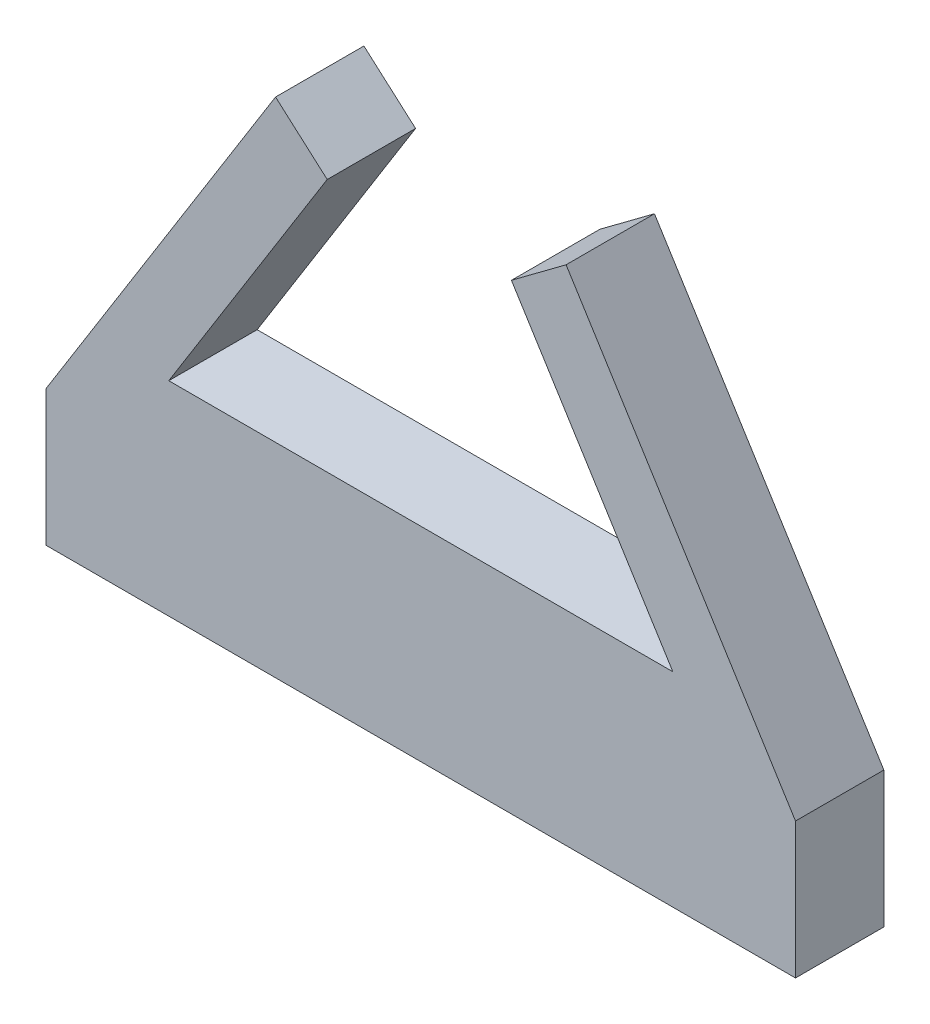
from build123d import *

# Parameters (mm, degrees)
BOSS_EXTRUDE1_DEPTH = 2.6
SKETCH2_W           = 22.04953915
SKETCH2_H           = 2.6
BOSS_EXTRUDE2_DEPTH = 4


with BuildPart() as part:
    # Sketch1 → Boss-Extrude1 (new body)
    with BuildSketch(Plane.XY):
        Polygon((4.274769575, 3.5), (2.666274292, 2.3), (5.254399491, -1.841000318), (7.416274292, -5.3), (-7.416274292, -5.3), (-5.254399491, -1.841000318), (-2.754399491, 2.158999682), (-4.274769575, 3.5), (-6.950396099, -0.781002438), (-11.024769575, -7.3), (11.024769575, -7.3), (6.950396099, -0.781002438), align=None)
    extrude(amount=BOSS_EXTRUDE1_DEPTH)

    # Sketch2 → Boss-Extrude2 (add)
    with BuildSketch(Plane.XZ.offset(7.3)):
        with Locations((0, 1.3)):
            Rectangle(SKETCH2_W, SKETCH2_H)
    extrude(amount=BOSS_EXTRUDE2_DEPTH)


solid = part.part
